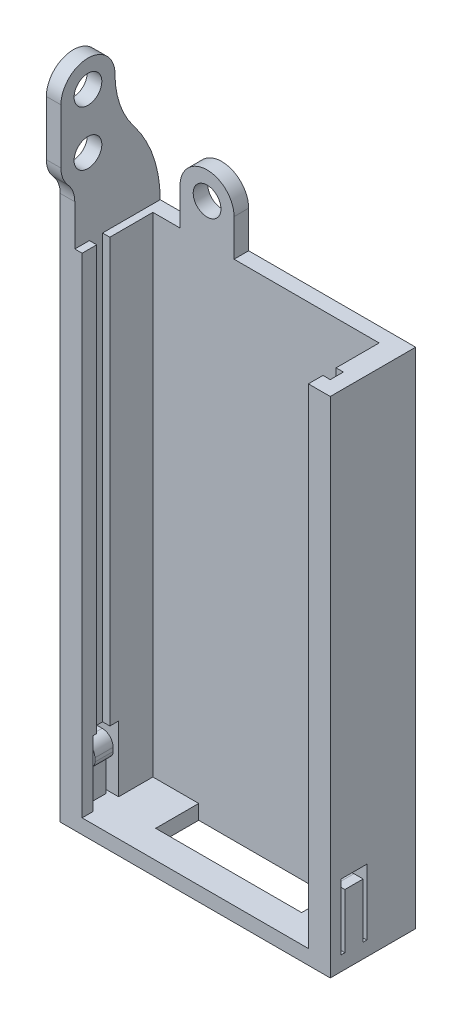
from build123d import *

# Parameters (mm, degrees)
SKETCH1_W           = 37
SKETCH1_H           = 11.7
BOSS_EXTRUDE1_DEPTH = 69
CUT_EXTRUDE1_DEPTH  = 67
SKETCH3_W           = 20
SKETCH3_H           = 5.9
CUT_EXTRUDE2_DEPTH  = 67
SKETCH5_R           = 1.9
BOSS_EXTRUDE3_DEPTH = 2
SKETCH7_R           = 1.9
BOSS_EXTRUDE4_DEPTH = 2
SKETCH8_W           = 3.5
SKETCH8_H           = 9
CUT_EXTRUDE3_DEPTH  = 40
BOSS_EXTRUDE5_START = 0.5
BOSS_EXTRUDE5_DEPTH = 2.5


with BuildPart() as part:
    # Sketch1 → Boss-Extrude1 (new body)
    with BuildSketch(Plane(origin=(0, 0, 0), x_dir=(1, 0, 0), z_dir=(0, 1, 0))):
        with Locations((18.5, 5.85)):
            Rectangle(SKETCH1_W, SKETCH1_H)
    extrude(amount=BOSS_EXTRUDE1_DEPTH)

    # Sketch2 → Cut-Extrude1 (cut)
    with BuildSketch(Plane(origin=(0, 69, 0), x_dir=(1, 0, 0), z_dir=(0, 1, 0))):
        Polygon((3, 0), (3, 2), (2, 2), (2, 3.8), (3, 3.8), (3, 9.7), (34, 9.7), (34, 3.8), (35, 3.8), (35, 2), (34, 2), (34, 0), align=None)
    extrude(amount=-CUT_EXTRUDE1_DEPTH, mode=Mode.SUBTRACT)

    # Sketch3 → Cut-Extrude2 (cut)
    with BuildSketch(Plane(origin=(0, 2, 0), x_dir=(1, 0, 0), z_dir=(0, 1, 0))):
        with Locations((19.275, 6.75)):
            Rectangle(SKETCH3_W, SKETCH3_H)
    extrude(amount=-CUT_EXTRUDE2_DEPTH, mode=Mode.SUBTRACT)

    # Sketch5 → Boss-Extrude3 (add)
    with BuildSketch(Plane(origin=(0, 0, -11.7), x_dir=(-1, 0, 0), z_dir=(0, 0, -1))):
        with BuildLine():
            Line((-14.12, 74.05), (-14.12, 69))
            Line((-14.12, 69), (-6.72, 69))
            Line((-6.72, 69), (-6.72, 74.05))
            ThreePointArc((-6.72, 74.05), (-10.42, 77.75), (-14.12, 74.05))
        make_face()
        with Locations((-10.42, 74.05)):
            Circle(SKETCH5_R, mode=Mode.SUBTRACT)
    extrude(amount=-BOSS_EXTRUDE3_DEPTH)

    # Sketch7 → Boss-Extrude4 (add)
    with BuildSketch(Plane.ZY):
        with BuildLine():
            Line((1.9, 87.05), (1.9, 79.55))
            ThreePointArc((1.9, 79.55), (1.65434509, 78.224292642), (0.95, 77.074621241))
            ThreePointArc((0.95, 77.074621241), (0.24565491, 75.924949841), (0, 74.599242482))
            Line((0, 74.599242482), (0, 69))
            Line((0, 69), (-11.7, 69))
            ThreePointArc((-11.7, 69), (-10.768790899, 74.577512686), (-8.076177285, 79.55))
            ThreePointArc((-8.076177285, 79.55), (-6.161996991, 83.084943588), (-5.5, 87.05))
            ThreePointArc((-5.5, 87.05), (-1.8, 90.75), (1.9, 87.05))
        make_face()
        with Locations((-1.8, 79.55)):
            Circle(SKETCH7_R, mode=Mode.SUBTRACT)
        with Locations((-1.8, 87.05)):
            Circle(SKETCH7_R, mode=Mode.SUBTRACT)
    extrude(amount=-BOSS_EXTRUDE4_DEPTH)

    # Sketch8 → Cut-Extrude3 (cut)
    with BuildSketch(Plane(origin=(37, 0, 0), x_dir=(0, 0, -1), z_dir=(1, 0, 0))):
        with Locations((3.25, 6.5)):
            Rectangle(SKETCH8_W, SKETCH8_H)
    extrude(amount=-CUT_EXTRUDE3_DEPTH, mode=Mode.SUBTRACT)

    # Sketch9 → Boss-Extrude5 (add)
    with BuildSketch(Plane.XY.offset(-5).offset(BOSS_EXTRUDE5_START)):
        with BuildLine():
            Line((37, 2), (37, 9.5))
            Line((37, 9.5), (35.75, 9.5))
            ThreePointArc((35.75, 9.5), (34.689339828, 9.060660172), (34.25, 8))
            Line((34.25, 8), (34.25, 7.5))
            ThreePointArc((34.25, 7.5), (34.542893219, 6.792893219), (35.25, 6.5))
            Line((35.25, 6.5), (35.25, 2))
            Line((35.25, 2), (37, 2))
        make_face()
    boss_extrude5 = extrude(amount=BOSS_EXTRUDE5_DEPTH)

    # Mirror1: Boss-Extrude5 across plane
    add(boss_extrude5.mirror(Plane(origin=(18.5, 0, 0), x_dir=(0, 0, 1), z_dir=(1, 0, 0))))


solid = part.part
